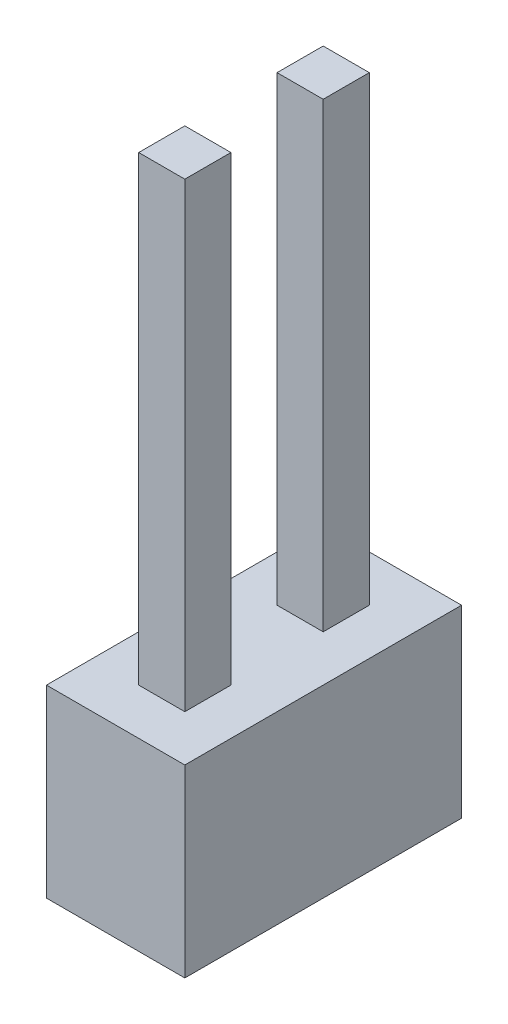
from build123d import *

# Parameters (mm, degrees)
SKETCH1_W      = 2.286
SKETCH1_H      = 4.572
EXTRUDE1_DEPTH = 3.048
SKETCH2_W      = 0.762
SKETCH2_H      = 0.762
EXTRUDE2_DEPTH = 7.62


with BuildPart() as part:
    # Sketch1 → Extrude1 (new body)
    with BuildSketch(Plane(origin=(0, 0, 0), x_dir=(1, 0, 0), z_dir=(0, 1, 0))):
        with Locations((1.143, 2.286)):
            Rectangle(SKETCH1_W, SKETCH1_H)
    extrude(amount=EXTRUDE1_DEPTH)

    # Sketch2 → Extrude2 (add)
    with BuildSketch(Plane(origin=(0, 3.048, 0), x_dir=(1, 0, 0), z_dir=(0, 1, 0))):
        with Locations((1.143, 1.143)):
            Rectangle(SKETCH2_W, SKETCH2_H)
        with Locations((1.143, 3.429)):
            Rectangle(SKETCH2_W, SKETCH2_H)
    extrude(amount=EXTRUDE2_DEPTH)


solid = part.part
